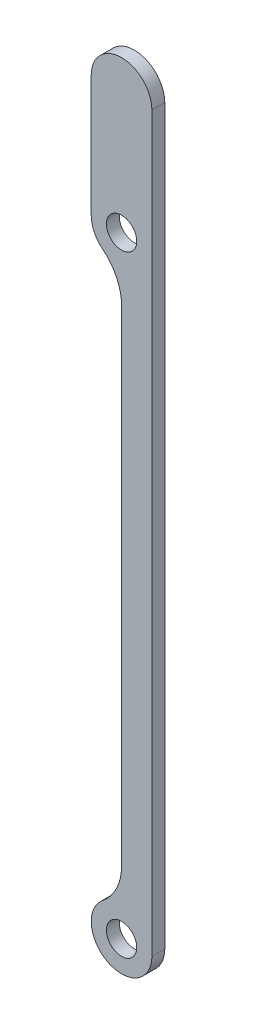
from build123d import *

# Parameters (mm, degrees)
MODEL_R             = 3
BOSS_EXTRUDE1_DEPTH = 2.55


with BuildPart() as part:
    # Model → Boss-Extrude1 (new body)
    with BuildSketch(Plane.XY):
        with BuildLine():
            Line((6, 120), (6, 145))
            ThreePointArc((6, 145), (0, 151), (-6, 145))
            Line((-6, 145), (-6, 121))
            ThreePointArc((-6, 121), (-5.408326913, 118.401923789), (-3.75, 116.316251501))
            ThreePointArc((-3.75, 116.316251501), (-0.986121811, 112.840131022), (0, 108.510004003))
            Line((0, 108.510004003), (0, 12.489995997))
            ThreePointArc((0, 12.489995997), (-0.986121811, 8.159868978), (-3.75, 4.683748499))
            ThreePointArc((-3.75, 4.683748499), (-2.598076211, -5.408326913), (6, 0))
            Line((6, 0), (6, 120))
        make_face()
        Circle(MODEL_R, mode=Mode.SUBTRACT)
        with Locations((0, 121)):
            Circle(MODEL_R, mode=Mode.SUBTRACT)
    extrude(amount=BOSS_EXTRUDE1_DEPTH)


solid = part.part
